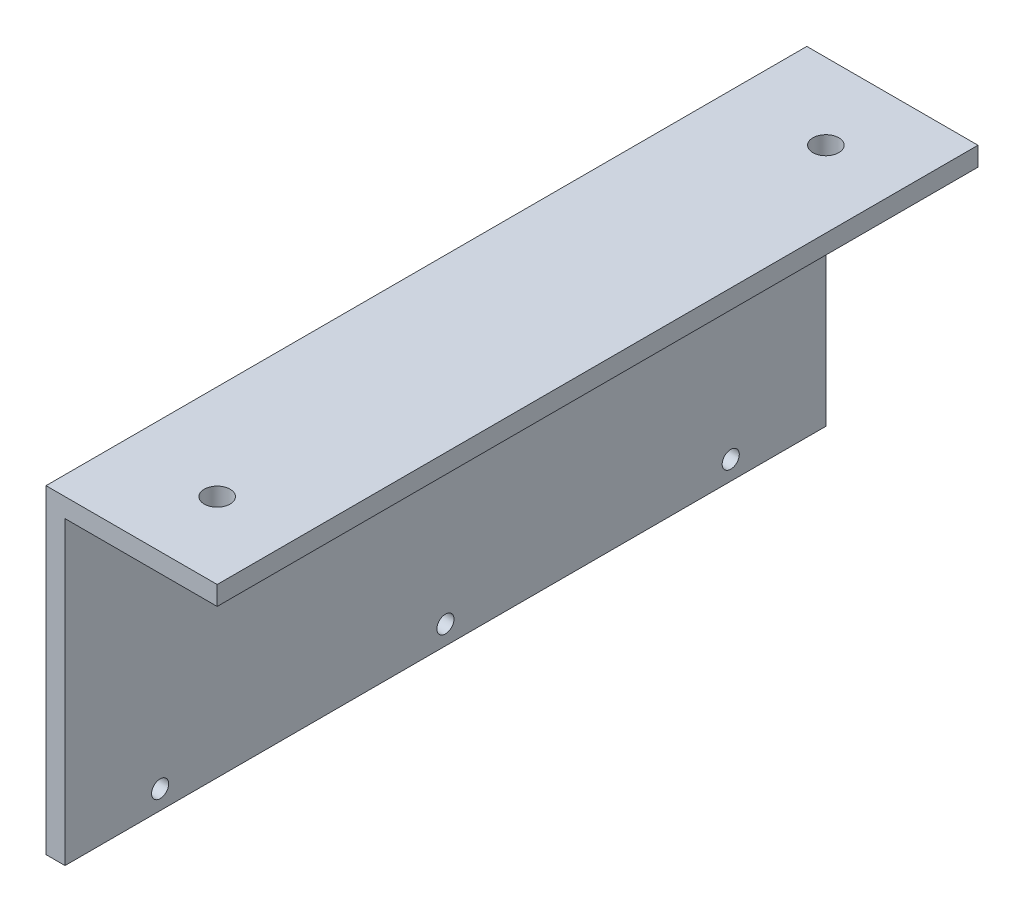
from build123d import *

# Parameters (mm, degrees)
BOSS_EXTRU_1_DEPTH = 200
TROU_TARAUD_M81_D  = 6.8
D_GAGEMENT_M41_D   = 4.5


with BuildPart() as part:
    # Esquisse1 → Boss.-Extru.1 (new body)
    with BuildSketch(Plane.XY):
        Polygon((0, 0), (0, 84), (45, 84), (45, 79), (5, 79), (5, 0), align=None)
    extrude(amount=BOSS_EXTRU_1_DEPTH)

    # Trou taraudé M81 (through all)
    with Locations(Plane(origin=(0, 79, 0), x_dir=(-1, 0, 0), z_dir=(0, -1, 0))):
        with Locations((-25, -180), (-25, -20)):
            Hole(TROU_TARAUD_M81_D / 2)

    # Dégagement M41 (through all)
    with Locations(Plane.ZY):
        with Locations((175, 5), (100, 5), (25, 5)):
            Hole(D_GAGEMENT_M41_D / 2)


solid = part.part
